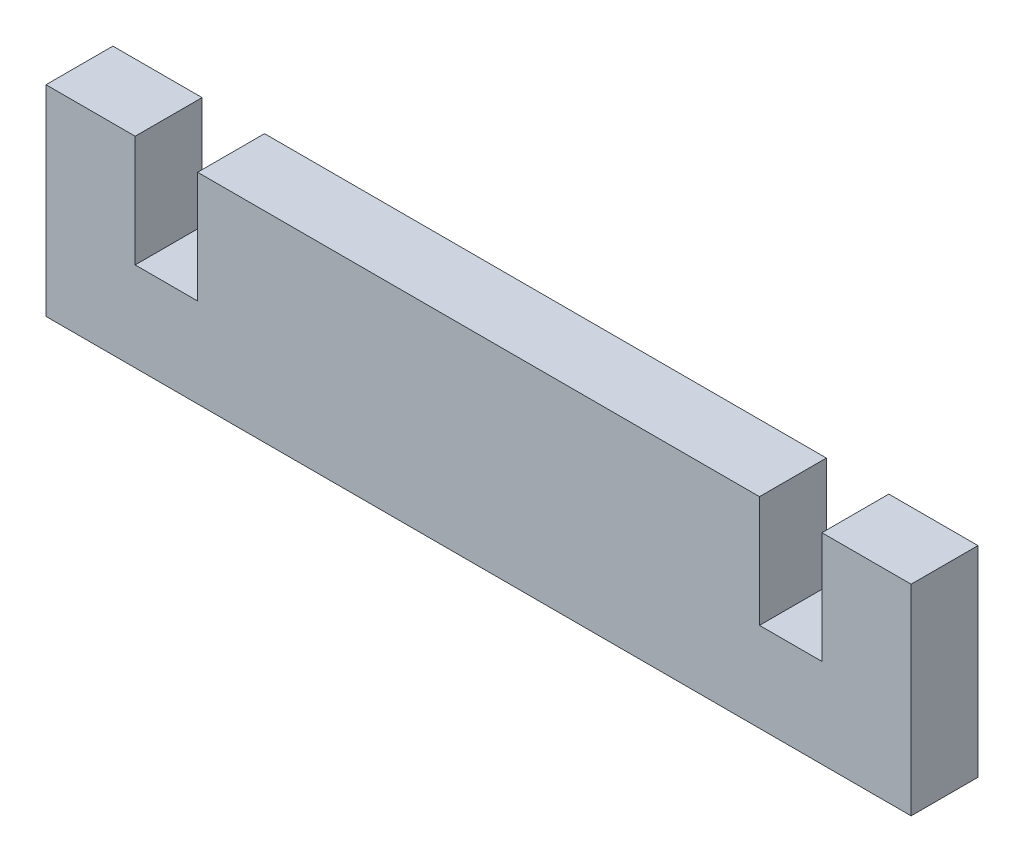
from build123d import *

# Parameters (mm, degrees)
BOSS_EXTRU_1_DEPTH = 6


with BuildPart() as part:
    # Esquisse1 → Boss.-Extru.1 (new body)
    with BuildSketch(Plane.XY):
        Polygon((0, 0), (0, 18), (8, 18), (8, 8), (13.6, 8), (13.6, 18), (64, 18), (64, 8), (69.6, 8), (69.6, 18), (77.6, 18), (77.6, 0), align=None)
    extrude(amount=BOSS_EXTRU_1_DEPTH)


solid = part.part
